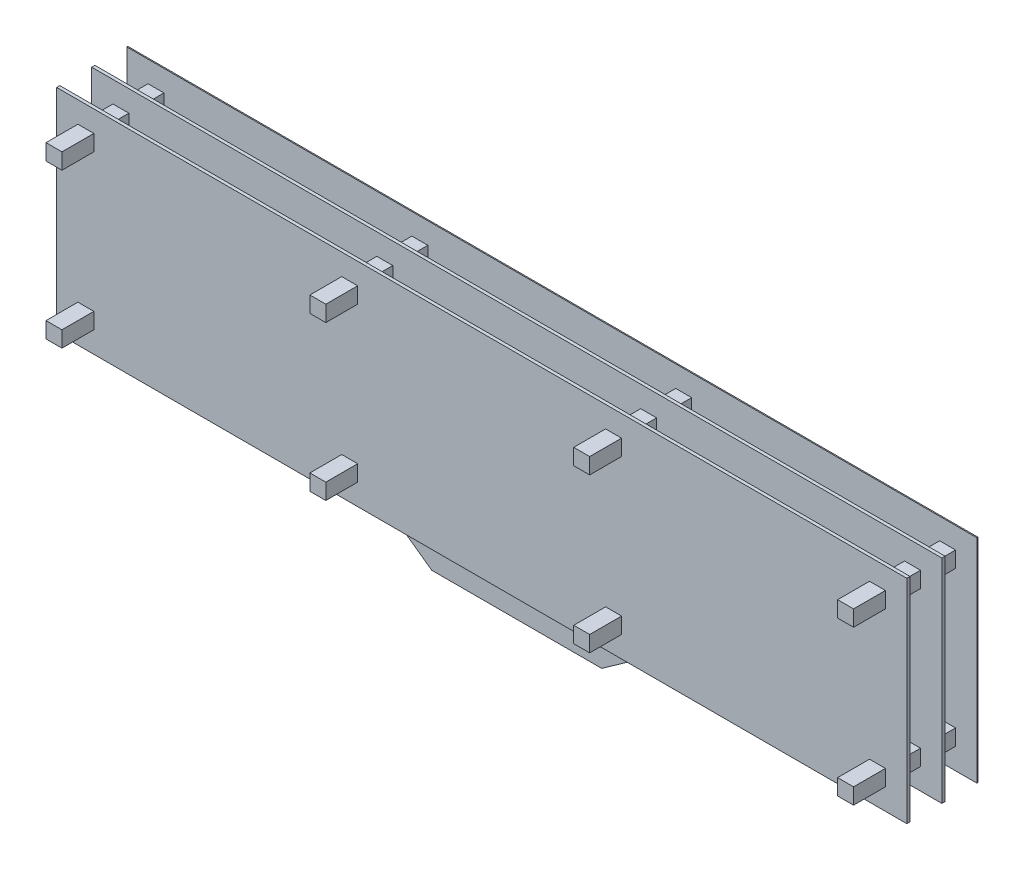
from build123d import *

# Parameters (mm, degrees)
SKETCH1_W                 = 80
SKETCH1_H                 = 20
BOSS_EXTRUDE1_DEPTH       = 0.1
SKETCH3_W                 = 1.5
SKETCH3_H                 = 1.5
BOSS_EXTRUDE2_DEPTH       = 3
BOSS_EXTRUDE3_DEPTH       = 0.3
LPATTERN1_COUNT           = 2
LPATTERN1_PITCH           = 3.3
SKETCH6_W                 = 80
SKETCH6_H                 = 20
BOSS_EXTRUDE4_DEPTH       = 0.3
LPATTERN3_COPY_1_SKETCH_W = 1.5
LPATTERN3_COPY_1_SKETCH_H = 1.5
LPATTERN3_COPY_1_DEPTH    = 3
LPATTERN3_COPY_2_SKETCH_W = 1.5
LPATTERN3_COPY_2_SKETCH_H = 1.5
LPATTERN3_COPY_2_DEPTH    = 3
SCALE1_SCALE              = 1000


with BuildPart() as part:
    # Sketch1 → Boss-Extrude1 (new body)
    with BuildSketch(Plane.XY):
        Rectangle(SKETCH1_W, SKETCH1_H)
    extrude(amount=BOSS_EXTRUDE1_DEPTH)

    # Sketch3 → Boss-Extrude2 (add)
    with BuildSketch(Plane.XY.offset(0.1)):
        with Locations((-37.25, 7.25)):
            Rectangle(SKETCH3_W, SKETCH3_H)
        with Locations((-12.42, 7.25)):
            Rectangle(SKETCH3_W, SKETCH3_H)
        with Locations((12.41, 7.25)):
            Rectangle(SKETCH3_W, SKETCH3_H)
        with Locations((37.24, 7.25)):
            Rectangle(SKETCH3_W, SKETCH3_H)
        with Locations((-12.42, -7.25)):
            Rectangle(SKETCH3_W, SKETCH3_H)
        with Locations((12.41, -7.25)):
            Rectangle(SKETCH3_W, SKETCH3_H)
        with Locations((37.24, -7.25)):
            Rectangle(SKETCH3_W, SKETCH3_H)
        with Locations((-37.25, -7.25)):
            Rectangle(SKETCH3_W, SKETCH3_H)
    boss_extrude2 = extrude(amount=BOSS_EXTRUDE2_DEPTH)

    # Sketch4 → Boss-Extrude3 (add)
    with BuildSketch(Plane.XY.offset(3.1)):
        Polygon((-40, 10), (40, 10), (40, -10), (15, -10), (8, -15), (-8, -15), (-15, -10), (-40, -10), align=None)
    extrude(amount=BOSS_EXTRUDE3_DEPTH)

    # LPattern1: Boss-Extrude2 ×2
    with Locations(*[(0, 0, i * LPATTERN1_PITCH) for i in range(1, LPATTERN1_COUNT)]):
        add(boss_extrude2)

    # Sketch6 → Boss-Extrude4 (add)
    with BuildSketch(Plane.XY.offset(6.4)):
        Rectangle(SKETCH6_W, SKETCH6_H)
    extrude(amount=BOSS_EXTRUDE4_DEPTH)

    # LPattern3 copy 1 sketch → LPattern3 copy 1 (add)
    with BuildSketch(Plane.XY.offset(6.7)):
        with Locations((-37.25, 7.25)):
            Rectangle(LPATTERN3_COPY_1_SKETCH_W, LPATTERN3_COPY_1_SKETCH_H)
        with Locations((-12.42, 7.25)):
            Rectangle(LPATTERN3_COPY_1_SKETCH_W, LPATTERN3_COPY_1_SKETCH_H)
        with Locations((12.41, 7.25)):
            Rectangle(LPATTERN3_COPY_1_SKETCH_W, LPATTERN3_COPY_1_SKETCH_H)
        with Locations((37.24, 7.25)):
            Rectangle(LPATTERN3_COPY_1_SKETCH_W, LPATTERN3_COPY_1_SKETCH_H)
        with Locations((-12.42, -7.25)):
            Rectangle(LPATTERN3_COPY_1_SKETCH_W, LPATTERN3_COPY_1_SKETCH_H)
        with Locations((12.41, -7.25)):
            Rectangle(LPATTERN3_COPY_1_SKETCH_W, LPATTERN3_COPY_1_SKETCH_H)
        with Locations((37.24, -7.25)):
            Rectangle(LPATTERN3_COPY_1_SKETCH_W, LPATTERN3_COPY_1_SKETCH_H)
        with Locations((-37.25, -7.25)):
            Rectangle(LPATTERN3_COPY_1_SKETCH_W, LPATTERN3_COPY_1_SKETCH_H)
    extrude(amount=LPATTERN3_COPY_1_DEPTH)

    # LPattern3 copy 2 sketch → LPattern3 copy 2 (add)
    with BuildSketch(Plane.XY.offset(3.4)):
        with Locations((-37.25, 7.25)):
            Rectangle(LPATTERN3_COPY_2_SKETCH_W, LPATTERN3_COPY_2_SKETCH_H)
        with Locations((-12.42, 7.25)):
            Rectangle(LPATTERN3_COPY_2_SKETCH_W, LPATTERN3_COPY_2_SKETCH_H)
        with Locations((12.41, 7.25)):
            Rectangle(LPATTERN3_COPY_2_SKETCH_W, LPATTERN3_COPY_2_SKETCH_H)
        with Locations((37.24, 7.25)):
            Rectangle(LPATTERN3_COPY_2_SKETCH_W, LPATTERN3_COPY_2_SKETCH_H)
        with Locations((-12.42, -7.25)):
            Rectangle(LPATTERN3_COPY_2_SKETCH_W, LPATTERN3_COPY_2_SKETCH_H)
        with Locations((12.41, -7.25)):
            Rectangle(LPATTERN3_COPY_2_SKETCH_W, LPATTERN3_COPY_2_SKETCH_H)
        with Locations((37.24, -7.25)):
            Rectangle(LPATTERN3_COPY_2_SKETCH_W, LPATTERN3_COPY_2_SKETCH_H)
        with Locations((-37.25, -7.25)):
            Rectangle(LPATTERN3_COPY_2_SKETCH_W, LPATTERN3_COPY_2_SKETCH_H)
    extrude(amount=LPATTERN3_COPY_2_DEPTH)


with BuildPart() as part_1:
    # Scale1: scaled about (0, 0, 0)
    add(part.part.scale(SCALE1_SCALE))


solid = part_1.part
